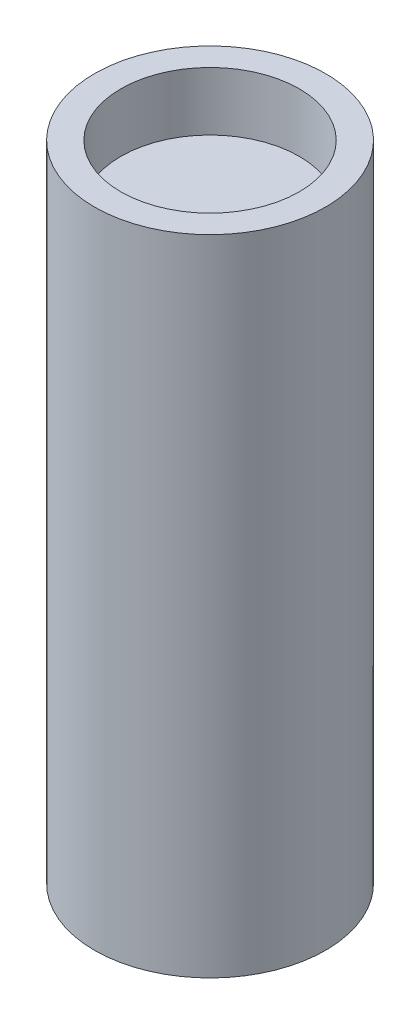
from build123d import *

# Parameters (mm, degrees)
SKETCH_2_R      = 3.95
EXTRUDE_1_DEPTH = 20
SKETCH_8_R      = 3.95
SKETCH_8_R_2    = 3.05
EXTRUDE_3_DEPTH = 2


with BuildPart() as part:
    # 草图2 → 凸台-拉伸1 (new body)
    with BuildSketch(Plane(origin=(0, 0, 0), x_dir=(1, 0, 0), z_dir=(0, 1, 0))):
        with Locations(Location((0, 0, 0), (0, 0, 270))):
            Circle(SKETCH_2_R)
    extrude(amount=EXTRUDE_1_DEPTH)

    # 草图8 → 凸台-拉伸3 (add)
    with BuildSketch(Plane(origin=(0, 20, 0), x_dir=(1, 0, 0), z_dir=(0, 1, 0))):
        with Locations(Location((0, 0, 0), (0, 0, 270))):
            Circle(SKETCH_8_R)
        with Locations(Location((0, 0, 0), (0, 0, 270))):
            Circle(SKETCH_8_R_2, mode=Mode.SUBTRACT)
    extrude(amount=EXTRUDE_3_DEPTH)


solid = part.part
